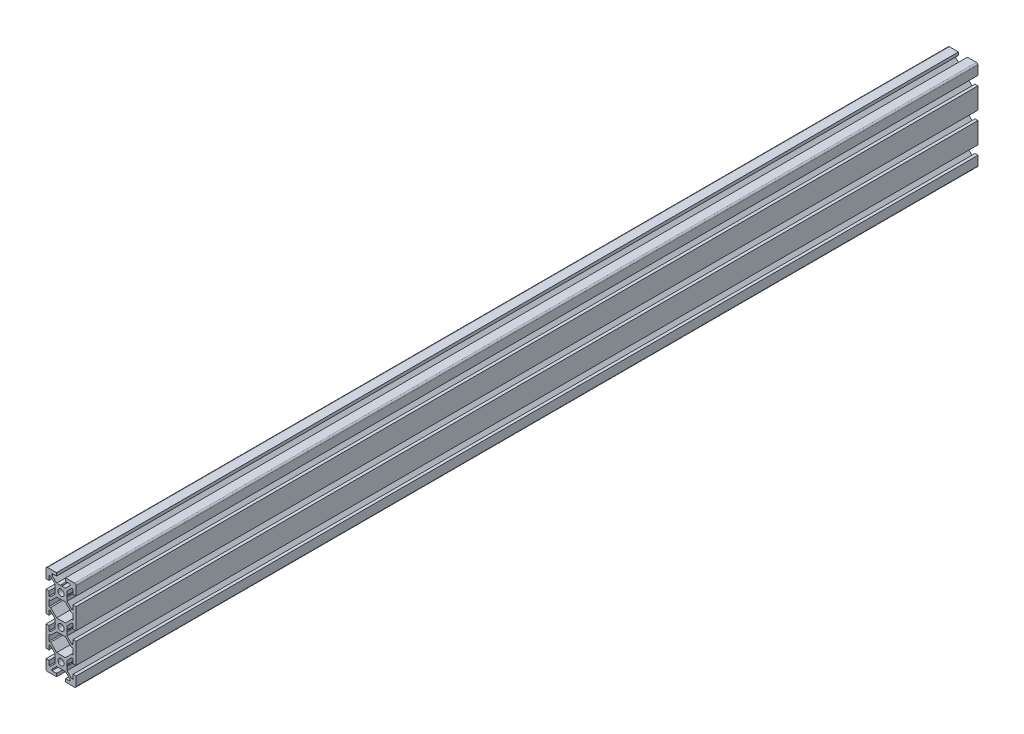
from build123d import *

# Parameters (mm, degrees)
BOSS_EXTRUDE1_DEPTH = 600
SKETCH2_W           = 600
SKETCH2_H           = 2.1
SKETCH3_W           = 600
SKETCH3_H           = 2.1
SKETCH4_W           = 600
SKETCH4_H           = 2.1


with BuildPart() as part:
    # Sketch1 → Boss-Extrude1 (new body)
    with BuildSketch(Plane.XY):
        with BuildLine():
            Line((-10, -17), (-8, -17))
            Line((-8, -17), (-8, -14))
            Line((-8, -14), (-7.060660172, -14))
            Line((-7.060660172, -14), (-4, -17.060660172))
            Line((-4, -17.060660172), (-4, -19.480384758))
            Line((-4, -19.480384758), (-3.7, -20))
            Line((-3.7, -20), (-4, -20.519615242))
            Line((-4, -20.519615242), (-4, -22.939339828))
            Line((-4, -22.939339828), (-7.060660172, -26))
            Line((-7.060660172, -26), (-8, -26))
            Line((-8, -26), (-8, -23))
            Line((-8, -23), (-10, -23))
            Line((-10, -23), (-10, -29))
            ThreePointArc((-10, -29), (-9.707106781, -29.707106781), (-9, -30))
            Line((-9, -30), (-3, -30))
            Line((-3, -30), (-3, -28))
            Line((-3, -28), (-6, -28))
            Line((-6, -28), (-6, -27.060660172))
            Line((-6, -27.060660172), (-2.939339828, -24))
            Line((-2.939339828, -24), (-0.519615242, -24))
            Line((-0.519615242, -24), (0, -23.7))
            Line((0, -23.7), (0.519615242, -24))
            Line((0.519615242, -24), (2.939339828, -24))
            Line((2.939339828, -24), (6, -27.060660172))
            Line((6, -27.060660172), (6, -28))
            Line((6, -28), (3, -28))
            Line((3, -28), (3, -30))
            Line((3, -30), (9, -30))
            ThreePointArc((9, -30), (9.707106781, -29.707106781), (10, -29))
            Line((10, -29), (10, -23))
            Line((10, -23), (8, -23))
            Line((8, -23), (8, -26))
            Line((8, -26), (7.060660172, -26))
            Line((7.060660172, -26), (4, -22.939339828))
            Line((4, -22.939339828), (4, -20.519615242))
            Line((4, -20.519615242), (3.7, -20))
            Line((3.7, -20), (4, -19.480384758))
            Line((4, -19.480384758), (4, -17.060660172))
            Line((4, -17.060660172), (7.060660172, -14))
            Line((7.060660172, -14), (8, -14))
            Line((8, -14), (8, -17))
            Line((8, -17), (10, -17))
            Line((10, -17), (10, -3))
            Line((10, -3), (8, -3))
            Line((8, -3), (8, -6))
            Line((8, -6), (7.060660172, -6))
            Line((7.060660172, -6), (4, -2.939339828))
            Line((4, -2.939339828), (4, -0.519615242))
            Line((4, -0.519615242), (3.7, 0))
            Line((3.7, 0), (4, 0.519615242))
            Line((4, 0.519615242), (4, 2.939339828))
            Line((4, 2.939339828), (7.060660172, 6))
            Line((7.060660172, 6), (8, 6))
            Line((8, 6), (8, 3))
            Line((8, 3), (10, 3))
            Line((10, 3), (10, 17))
            Line((10, 17), (8, 17))
            Line((8, 17), (8, 14))
            Line((8, 14), (7.060660172, 14))
            Line((7.060660172, 14), (4, 17.060660172))
            Line((4, 17.060660172), (4, 19.480384758))
            Line((4, 19.480384758), (3.7, 20))
            Line((3.7, 20), (4, 20.519615242))
            Line((4, 20.519615242), (4, 22.939339828))
            Line((4, 22.939339828), (7.060660172, 26))
            Line((7.060660172, 26), (8, 26))
            Line((8, 26), (8, 23))
            Line((8, 23), (10, 23))
            Line((10, 23), (10, 29))
            ThreePointArc((10, 29), (9.707106781, 29.707106781), (9, 30))
            Line((9, 30), (3, 30))
            Line((3, 30), (3, 28))
            Line((3, 28), (6, 28))
            Line((6, 28), (6, 27.060660172))
            Line((6, 27.060660172), (2.939339828, 24))
            Line((2.939339828, 24), (0.519615242, 24))
            Line((0.519615242, 24), (0, 23.7))
            Line((0, 23.7), (-0.519615242, 24))
            Line((-0.519615242, 24), (-2.939339828, 24))
            Line((-2.939339828, 24), (-6, 27.060660172))
            Line((-6, 27.060660172), (-6, 28))
            Line((-6, 28), (-3, 28))
            Line((-3, 28), (-3, 30))
            Line((-3, 30), (-9, 30))
            ThreePointArc((-9, 30), (-9.707106781, 29.707106781), (-10, 29))
            Line((-10, 29), (-10, 23))
            Line((-10, 23), (-8, 23))
            Line((-8, 23), (-8, 26))
            Line((-8, 26), (-7.060660172, 26))
            Line((-7.060660172, 26), (-4, 22.939339828))
            Line((-4, 22.939339828), (-4, 20.519615242))
            Line((-4, 20.519615242), (-3.7, 20))
            Line((-3.7, 20), (-4, 19.480384758))
            Line((-4, 19.480384758), (-4, 17.060660172))
            Line((-4, 17.060660172), (-7.060660172, 14))
            Line((-7.060660172, 14), (-8, 14))
            Line((-8, 14), (-8, 17))
            Line((-8, 17), (-10, 17))
            Line((-10, 17), (-10, 3))
            Line((-10, 3), (-8, 3))
            Line((-8, 3), (-8, 6))
            Line((-8, 6), (-7.060660172, 6))
            Line((-7.060660172, 6), (-4, 2.939339828))
            Line((-4, 2.939339828), (-4, 0.519615242))
            Line((-4, 0.519615242), (-3.7, 0))
            Line((-3.7, 0), (-4, -0.519615242))
            Line((-4, -0.519615242), (-4, -2.939339828))
            Line((-4, -2.939339828), (-7.060660172, -6))
            Line((-7.060660172, -6), (-8, -6))
            Line((-8, -6), (-8, -3))
            Line((-8, -3), (-10, -3))
            Line((-10, -3), (-10, -17))
        make_face()
        Polygon((-8, 8), (-6.939339828, 8), (-2.939339828, 4), (2.939339828, 4), (6.939339828, 8), (8, 8), (8, 12), (6.939339828, 12), (2.939339828, 16), (-2.939339828, 16), (-6.939339828, 12), (-8, 12), align=None, mode=Mode.SUBTRACT)
        Polygon((-8, -8), (-8, -12), (-6.939339828, -12), (-2.939339828, -16), (2.939339828, -16), (6.939339828, -12), (8, -12), (8, -8), (6.939339828, -8), (2.939339828, -4), (-2.939339828, -4), (-6.939339828, -8), align=None, mode=Mode.SUBTRACT)
    extrude(amount=-BOSS_EXTRUDE1_DEPTH)

    # Sketch2 → Cut-Revolve1 (revolve, cut)
    with BuildSketch(Plane(origin=(0, 0, 0), x_dir=(0, 0, -1), z_dir=(1, 0, 0)), mode=Mode.PRIVATE) as cut_revolve1_sk:
        with Locations((300, 18.95)):
            Rectangle(SKETCH2_W, SKETCH2_H)
    revolve(cut_revolve1_sk.sketch.rotate(Axis((0, 20, 0), (0, 0, -1)), 90), axis=Axis((0, 20, 0), (0, 0, -1)), mode=Mode.SUBTRACT)

    # Sketch3 → Cut-Revolve2 (revolve, cut)
    with BuildSketch(Plane(origin=(0, 0, 0), x_dir=(0, 0, -1), z_dir=(1, 0, 0)), mode=Mode.PRIVATE) as cut_revolve2_sk:
        with Locations((300, -1.05)):
            Rectangle(SKETCH3_W, SKETCH3_H)
    revolve(cut_revolve2_sk.sketch.rotate(Axis((0, 0, 0), (0, 0, -1)), 90), axis=Axis((0, 0, 0), (0, 0, -1)), mode=Mode.SUBTRACT)

    # Sketch4 → Cut-Revolve3 (revolve, cut)
    with BuildSketch(Plane(origin=(0, 0, 0), x_dir=(0, 0, -1), z_dir=(1, 0, 0)), mode=Mode.PRIVATE) as cut_revolve3_sk:
        with Locations((300, -21.05)):
            Rectangle(SKETCH4_W, SKETCH4_H)
    revolve(cut_revolve3_sk.sketch.rotate(Axis((0, -20, 0), (0, 0, -1)), 90), axis=Axis((0, -20, 0), (0, 0, -1)), mode=Mode.SUBTRACT)


solid = part.part
